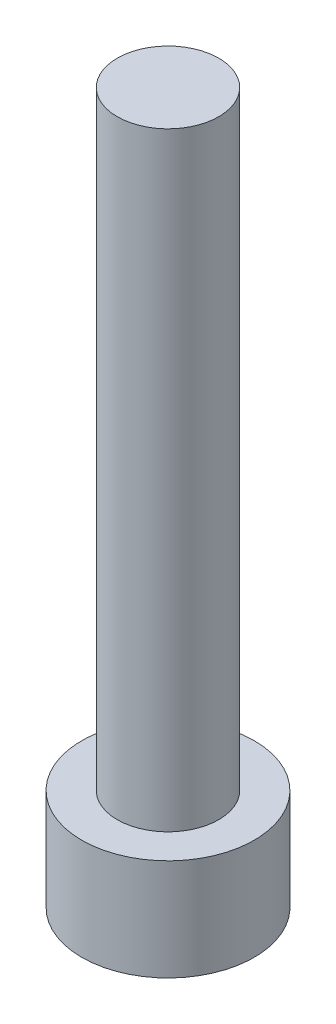
from build123d import *

# Parameters (mm, degrees)
SKETCH_1_R          = 4.25
EXTRUDE_1_DEPTH     = 5
EXTRUDE_START       = 5
SKETCH_2_R          = 2.5
EXTRUDE_2_DEPTH     = 30
CUT_EXTRUDE_1_DEPTH = 2.5


with BuildPart() as part:
    # 草图1 → 凸台-拉伸1 (new body)
    with BuildSketch(Plane(origin=(0, 0, 0), x_dir=(1, 0, 0), z_dir=(0, 1, 0))):
        with Locations(Location((0, 0, 0), (0, 0, 270))):
            Circle(SKETCH_1_R)
    extrude(amount=EXTRUDE_1_DEPTH)

    # 草图2 → 凸台-拉伸2 (add)
    with BuildSketch(Plane(origin=(0, 0, 0), x_dir=(1, 0, 0), z_dir=(0, 1, 0)).offset(EXTRUDE_START)):
        with Locations(Location((0, 0, 0), (0, 0, 270))):
            Circle(SKETCH_2_R)
    extrude(amount=EXTRUDE_2_DEPTH)

    # 草图4 → 切除-拉伸1 (cut)
    with BuildSketch(Plane(origin=(0, 0, 0), x_dir=(1, 0, 0), z_dir=(0, 1, 0))):
        Polygon((2.309401077, 0), (1.154700538, 2), (-1.154700538, 2), (-2.309401077, 0), (-1.154700538, -2), (1.154700538, -2), align=None)
    extrude(amount=CUT_EXTRUDE_1_DEPTH, mode=Mode.SUBTRACT)


solid = part.part
